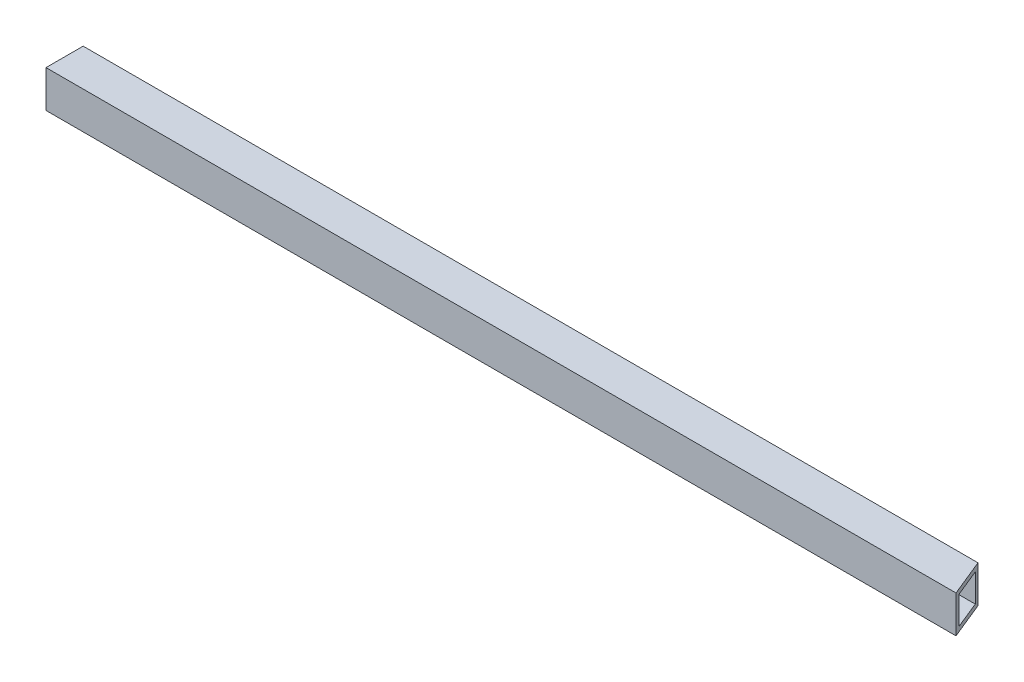
from build123d import *

# Parameters (mm, degrees)
SKETCH2_W           = 25.4
SKETCH2_H           = 25.4
SKETCH2_W_2         = 19.05
SKETCH2_H_2         = 19.05
BOSS_EXTRUDE1_DEPTH = 622.3
CUT_EXTRUDE1_REACH  = 624.948


with BuildPart() as part:
    # Sketch2 → Boss-Extrude1 (new body)
    with BuildSketch(Plane(origin=(0, 0, 0), x_dir=(0, 0, -1), z_dir=(1, 0, 0))):
        Rectangle(SKETCH2_W, SKETCH2_H)
        Rectangle(SKETCH2_W_2, SKETCH2_H_2, mode=Mode.SUBTRACT)
    extrude(amount=BOSS_EXTRUDE1_DEPTH)

    # Cut-Extrude1: up to this face of the body (flat: up to its plane)
    cut_extrude1_end = Plane(part.part.faces().sort_by_distance((311.15, -12.7, 0))[0])
    # Sketch3 → Cut-Extrude1 (cut, up to the picked face)
    with BuildSketch(Plane(origin=(0, 12.7, 0), x_dir=(1, 0, 0), z_dir=(0, 1, 0)), mode=Mode.PRIVATE) as cut_extrude1_sk1:
        Polygon((622.3, -12.7), (611.938792348, 12.7), (622.3, 12.7), align=None)
    cut_extrude1_tool1 = split(extrude(cut_extrude1_sk1.sketch, amount=-CUT_EXTRUDE1_REACH, mode=Mode.PRIVATE), bisect_by=cut_extrude1_end, keep=Keep.BOTH, mode=Mode.PRIVATE)
    add(cut_extrude1_tool1.solids().sort_by(Axis((618.846264, 12.7, -4.233333), (0, -1, 0)))[0], mode=Mode.SUBTRACT)


solid = part.part
